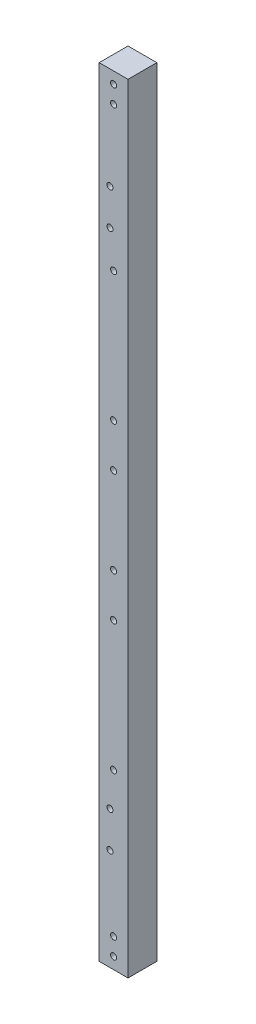
from build123d import *

# Parameters (mm, degrees)
SKETCH_1_W          = 20
SKETCH_1_H          = 20
EXTRUDE_1_DEPTH     = 540
SKETCH_2_R          = 2.1
CUT_EXTRUDE_1_DEPTH = 543.146184352
SKETCH_3_R          = 2.1
CUT_EXTRUDE_2_DEPTH = 543.146184352
SKETCH_4_R          = 2.1
CUT_EXTRUDE_3_DEPTH = 140


with BuildPart() as part:
    # 草图1 → 凸台-拉伸1 (new body)
    with BuildSketch(Plane(origin=(0, 0, 0), x_dir=(1, 0, 0), z_dir=(0, 1, 0))):
        with Locations((-33.846153846, 63.461538462)):
            Rectangle(SKETCH_1_W, SKETCH_1_H)
    extrude(amount=EXTRUDE_1_DEPTH)

    # 草图2 → 切除-拉伸1 (cut, through all)
    with BuildSketch(Plane.XY.offset(-53.461538462)):
        with Locations((-33.846153846, 330)):
            Circle(SKETCH_2_R)
        with Locations(Location((-33.846153846, 210, 0), (0, 0, 180))):
            Circle(SKETCH_2_R)
        with Locations((-33.846153846, 420)):
            Circle(SKETCH_2_R)
        with Locations((-33.846153846, 300)):
            Circle(SKETCH_2_R)
        with Locations((-33.846153846, 240)):
            Circle(SKETCH_2_R)
        with Locations((-33.846153846, 120)):
            Circle(SKETCH_2_R)
    extrude(amount=-CUT_EXTRUDE_1_DEPTH, mode=Mode.SUBTRACT)

    # 草图3 → 切除-拉伸2 (cut, through all)
    with BuildSketch(Plane.XY.offset(-53.461538462)):
        with Locations((-36.346153846, 70.5)):
            Circle(SKETCH_3_R)
        with Locations((-36.346153846, 95.5)):
            Circle(SKETCH_3_R)
        with Locations(Location((-36.346153846, 444.5, 0), (0, 0, 180))):
            Circle(SKETCH_3_R)
        with Locations(Location((-36.346153846, 469.5, 0), (0, 0, 180))):
            Circle(SKETCH_3_R)
    extrude(amount=-CUT_EXTRUDE_2_DEPTH, mode=Mode.SUBTRACT)

    # 草图4 → 切除-拉伸3 (cut)
    with BuildSketch(Plane.XY.offset(-53.461538462)):
        with Locations((-33.846153846, 8)):
            Circle(SKETCH_4_R)
        with Locations((-33.846153846, 20)):
            Circle(SKETCH_4_R)
        with Locations((-33.846153846, 520)):
            Circle(SKETCH_4_R)
        with Locations((-33.846153846, 532)):
            Circle(SKETCH_4_R)
    extrude(amount=-CUT_EXTRUDE_3_DEPTH, mode=Mode.SUBTRACT)


solid = part.part
